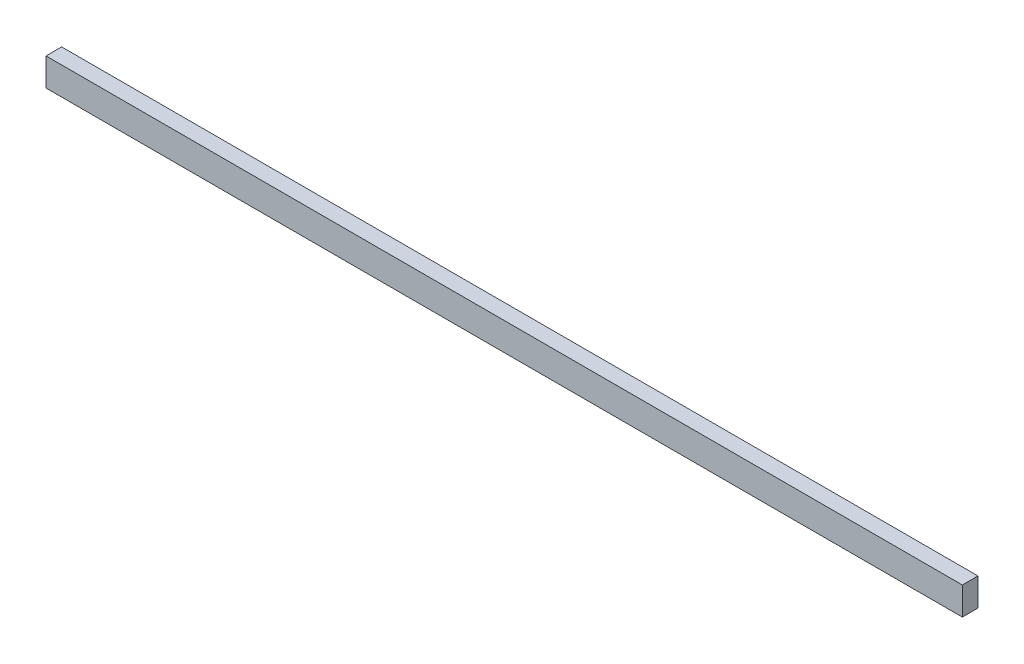
from build123d import *

# Parameters (mm, degrees)
SKETCH2_W           = 9
SKETCH2_H           = 16
BOSS_EXTRUDE1_DEPTH = 527


with BuildPart() as part:
    # Sketch2 → Boss-Extrude1 (new body)
    with BuildSketch(Plane(origin=(0, 0, 0), x_dir=(0, 0, -1), z_dir=(1, 0, 0))):
        with Locations((4.5, 8)):
            Rectangle(SKETCH2_W, SKETCH2_H)
    extrude(amount=BOSS_EXTRUDE1_DEPTH)


solid = part.part
